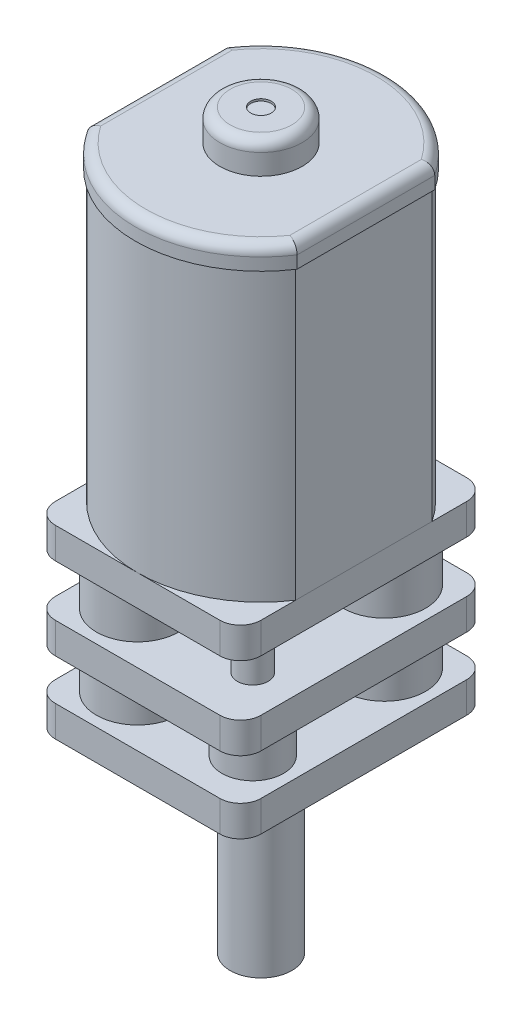
from build123d import *

# Parameters (mm, degrees)
EXTRUDE_1_DEPTH     = 15
SKETCH_2_R          = 2
SKETCH_2_R_2        = 0.5
EXTRUDE_2_DEPTH     = 1.6
SKETCH_3_R          = 0.5
EXTRUDE_3_DEPTH     = 1.5
SKETCH_4_W          = 10
SKETCH_4_H          = 12
EXTRUDE_4_DEPTH     = 9
SKETCH_5_R          = 1.5
EXTRUDE_5_DEPTH     = 10
EXTRUDE_START       = 1
SKETCH_6_R          = 2
SKETCH_6_R_2        = 1.5
EXTRUDE_6_DEPTH     = 1
SKETCH_7_W          = 12
SKETCH_7_H          = 6
CUT_EXTRUDE_1_DEPTH = 20
SKETCH_8_R          = 1
SKETCH_8_R_2        = 2
EXTRUDE_7_DEPTH     = 7
SKETCH_10_R         = 3
SKETCH_10_R_2       = 1.5
EXTRUDE_8_DEPTH     = 2
SKETCH_11_R         = 0.75
EXTRUDE_9_DEPTH     = 4
EXTRUDE_10_DEPTH    = 1
EXTRUDE_START_2     = 0.1
EXTRUDE_11_DEPTH    = 0.1
FILLET_1_R          = 0.5
FILLET_2_R          = 0.5
SKETCH_14_W         = 10
SKETCH_14_H         = 12
EXTRUDE_12_DEPTH    = 1.5
FILLET_3_R          = 1


with BuildPart() as part:
    # 草图1 → 凸台-拉伸1 (new body)
    with BuildSketch(Plane(origin=(0, 0, 0), x_dir=(1, 0, 0), z_dir=(0, 1, 0))):
        with BuildLine():
            Line((-5, 3.31662479), (-5, -3.31662479))
            ThreePointArc((-5, -3.31662479), (0, -6), (5, -3.31662479))
            Line((5, -3.31662479), (5, 3.31662479))
            ThreePointArc((5, 3.31662479), (0, 6), (-5, 3.31662479))
        make_face()
    extrude(amount=-EXTRUDE_1_DEPTH)

    # 草图2 → 凸台-拉伸2 (add)
    with BuildSketch(Plane(origin=(0, 0, 0), x_dir=(1, 0, 0), z_dir=(0, 1, 0))):
        with Locations(Location((0, 0, 0), (0, 0, 270))):
            Circle(SKETCH_2_R)
        with Locations(Location((0, 0, 0), (0, 0, 270))):
            Circle(SKETCH_2_R_2, mode=Mode.SUBTRACT)
    extrude(amount=EXTRUDE_2_DEPTH)

    # 草图3 → 凸台-拉伸3 (add)
    with BuildSketch(Plane(origin=(0, 0, 0), x_dir=(1, 0, 0), z_dir=(0, 1, 0))):
        with Locations(Location((0, 0, 0), (0, 0, 270))):
            Circle(SKETCH_3_R)
    extrude(amount=EXTRUDE_3_DEPTH)

    # 草图12 → 凸台-拉伸10 (add)
    with BuildSketch(Plane(origin=(0, 0, 0), x_dir=(1, 0, 0), z_dir=(0, 1, 0))):
        with BuildLine():
            Line((-5.1, 3.346640106), (-5.1, -3.346640106))
            ThreePointArc((-5.1, -3.346640106), (0, -6.1), (5.1, -3.346640106))
            Line((5.1, -3.346640106), (5.1, 3.346640106))
            ThreePointArc((5.1, 3.346640106), (0, 6.1), (-5.1, 3.346640106))
        make_face()
        with BuildLine():
            Line((-5, 3.31662479), (-5, -3.31662479))
            ThreePointArc((-5, -3.31662479), (0, -6), (5, -3.31662479))
            Line((5, -3.31662479), (5, 3.31662479))
            ThreePointArc((5, 3.31662479), (0, 6), (-5, 3.31662479))
        make_face(mode=Mode.SUBTRACT)
    extrude(amount=-EXTRUDE_10_DEPTH)

    # 草图13 → 凸台-拉伸11 (add)
    with BuildSketch(Plane(origin=(0, 0, 0), x_dir=(1, 0, 0), z_dir=(0, 1, 0)).offset(EXTRUDE_START_2)):
        with BuildLine():
            Line((-5.1, 3.346640106), (-5.1, -3.346640106))
            ThreePointArc((-5.1, -3.346640106), (0, -6.1), (5.1, -3.346640106))
            Line((5.1, -3.346640106), (5.1, 3.346640106))
            ThreePointArc((5.1, 3.346640106), (0, 6.1), (-5.1, 3.346640106))
        make_face()
    extrude(amount=-EXTRUDE_11_DEPTH)

    # 圆角1
    fillet_1_edges = [part.edges().sort_by_distance(p)[0] for p in [
        (0, 0.1, -6.1),
        (-5.1, 0.1, 0),
        (0, 0.1, 6.1),
        (5.1, 0.1, 0),
    ]]
    fillet(fillet_1_edges, radius=FILLET_1_R)

    # 圆角2
    fillet_2_edges = [part.edges().sort_by_distance(p)[0] for p in [
        (0, 1.6, -2),
    ]]
    fillet(fillet_2_edges, radius=FILLET_2_R)


with BuildPart() as body_2:
    # 草图4 → 凸台-拉伸4 (new body)
    with BuildSketch(Plane.XZ.offset(15)):
        Rectangle(SKETCH_4_W, SKETCH_4_H)
    extrude(amount=EXTRUDE_4_DEPTH)

    # 草图7 → 切除-拉伸1 (cut)
    with BuildSketch(Plane.ZY.offset(5)):
        with Locations((0, -19.5)):
            Rectangle(SKETCH_7_W, SKETCH_7_H)
    extrude(amount=-CUT_EXTRUDE_1_DEPTH, mode=Mode.SUBTRACT)


with BuildPart() as body_3:
    # 草图5 → 凸台-拉伸5 (new body)
    with BuildSketch(Plane.XZ.offset(24)):
        with Locations(Location((0, 0, 0), (0, 0, 270))):
            Circle(SKETCH_5_R)
    extrude(amount=EXTRUDE_5_DEPTH)


with BuildPart() as body_4:
    # 草图6 → 凸台-拉伸6 (new body)
    with BuildSketch(Plane.XZ.offset(24).offset(EXTRUDE_START)):
        with Locations(Location((0, 0, 0), (0, 0, 270))):
            Circle(SKETCH_6_R)
        with Locations(Location((0, 0, 0), (0, 0, 270))):
            Circle(SKETCH_6_R_2, mode=Mode.SUBTRACT)
    extrude(amount=-EXTRUDE_6_DEPTH)


with BuildPart() as cut_extrude_1_piece_1:
    # of the separate pieces the step leaves, piece 1, a body of its own (cut_extrude_1_pieces)
    add(body_2.part.solids().sort_by_distance((5, -15, -6))[0])

    # 草图8 → 凸台-拉伸7 (add)
    with BuildSketch(Plane.XZ.offset(16.5)):
        with Locations(Location((0, 0, 0), (0, 0, 90))):
            Circle(SKETCH_8_R)
        with Locations(Location((2.5, -3.5, 0), (0, 0, 90))):
            Circle(SKETCH_8_R_2)
        with Locations(Location((-2.5, 3.5, 0), (0, 0, 90))):
            Circle(SKETCH_8_R_2)
    extrude(amount=EXTRUDE_7_DEPTH)



with BuildPart() as cut_extrude_1_piece_2:
    # of the separate pieces the step leaves, piece 2, a body of its own (cut_extrude_1_pieces)
    add(body_2.part.solids().sort_by_distance((-5, -22.5, -6))[0])


with BuildPart() as cut_extrude_1_piece_1_1:
    add(cut_extrude_1_piece_1.part)

    add(cut_extrude_1_piece_2.part)  # 凸台-拉伸8 merges 切除-拉伸1 piece 2
    # 草图10 → 凸台-拉伸8 (add)
    with BuildSketch(Plane(origin=(0, -20.5, 0), x_dir=(-1, 0, 0), z_dir=(0, -1, 0))):
        Circle(SKETCH_10_R)
        with Locations(Location((-3, -3.4, 0), (0, 0, 90))):
            Circle(SKETCH_10_R_2)
    extrude(amount=EXTRUDE_8_DEPTH)

    # 草图11 → 凸台-拉伸9 (add)
    with BuildSketch(Plane(origin=(0, -20.5, 0), x_dir=(1, 0, 0), z_dir=(0, 1, 0))):
        with Locations(Location((3, -3.4, 0), (0, 0, 270))):
            Circle(SKETCH_11_R)
    extrude(amount=EXTRUDE_9_DEPTH)

    # 草图14 → 凸台-拉伸12 (add)
    with BuildSketch(Plane(origin=(0, -20.5, 0), x_dir=(1, 0, 0), z_dir=(0, 1, 0))):
        Rectangle(SKETCH_14_W, SKETCH_14_H)
    extrude(amount=EXTRUDE_12_DEPTH)

    # 圆角3
    fillet_3_edges = [cut_extrude_1_piece_1_1.edges().sort_by_distance(p)[0] for p in [
        (-5, -15.75, 6),
        (-5, -15.75, -6),
        (5, -15.75, -6),
        (5, -15.75, 6),
        (-5, -23.25, 6),
        (5, -23.25, 6),
        (5, -23.25, -6),
        (-5, -23.25, -6),
        (5, -19.75, 6),
        (5, -19.75, -6),
        (-5, -19.75, -6),
        (-5, -19.75, 6),
    ]]
    fillet(fillet_3_edges, radius=FILLET_3_R)


solid = Compound([part.part, body_3.part, body_4.part, cut_extrude_1_piece_1_1.part])
